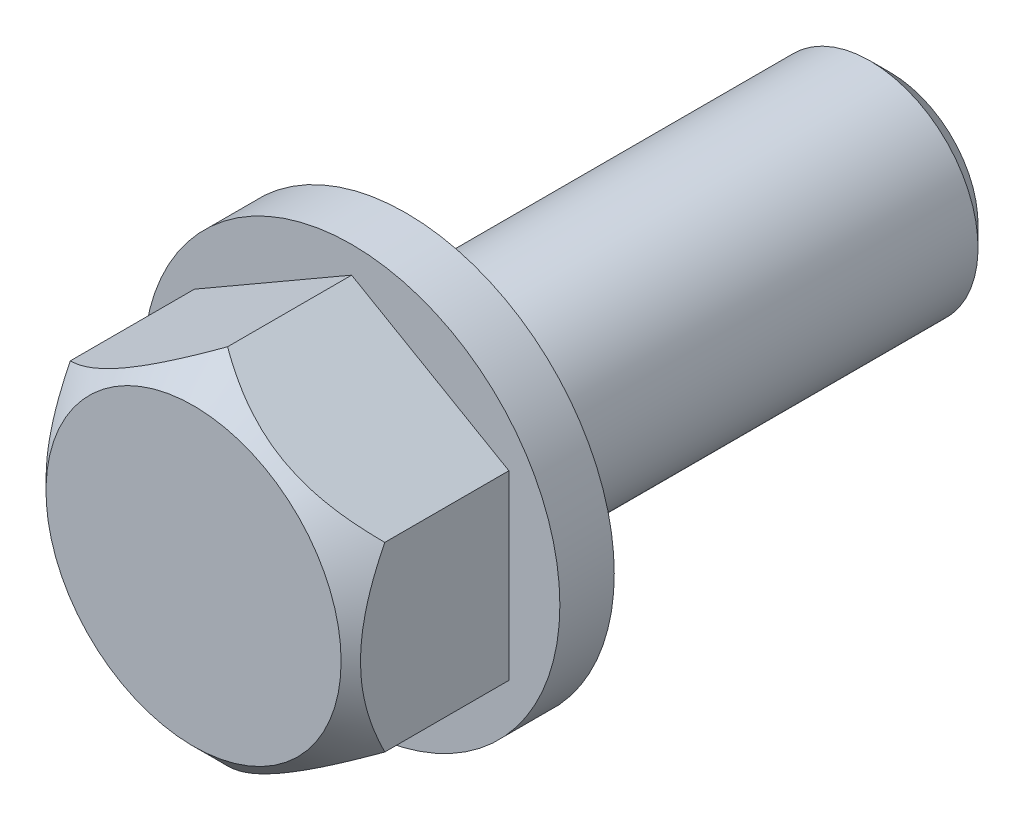
from build123d import *

# Parameters (mm, degrees)
BOSS_EXTRUDE1_DEPTH = 9.3
CHAMFER1_SIZE       = 1.2


with BuildPart() as part:
    # Sketch1 → Boss-Extrude1 (new body)
    with BuildSketch(Plane.XY):
        Polygon((9.25, -5.34048999), (9.25, 5.34048999), (0, 10.68097998), (-9.25, 5.34048999), (-9.25, -5.34048999), (0, -10.68097998), align=None)
    extrude(amount=-BOSS_EXTRUDE1_DEPTH)

    # Sketch2 → Revolve1 (revolve)
    with BuildSketch(Plane(origin=(0, 0, 0), x_dir=(0, 0, -1), z_dir=(1, 0, 0))):
        Polygon((9.3, 12.25), (12.5, 12.25), (12.5, 6.35), (41, 6.35), (41, 0), (9.3, 0), align=None)
    revolve(axis=Axis((0, 0, -41), (0, 0, 1)))

    # Sketch3 → Cut-Revolve1 (revolve, cut)
    with BuildSketch(Plane(origin=(0, 0, 0), x_dir=(0, 0, -1), z_dir=(1, 0, 0)), mode=Mode.PRIVATE) as cut_revolve1_sk:
        Polygon((0, 8.68097998), (2, 10.68097998), (0, 10.68097998), align=None)
    revolve(cut_revolve1_sk.sketch.rotate(Axis((0, 0, 0), (0, 0, -1)), 300.000000037), axis=Axis((0, 0, 0), (0, 0, -1)), mode=Mode.SUBTRACT)

    # Chamfer1
    chamfer1_edges = [part.edges().sort_by_distance(p)[0] for p in [
        (0, -6.35, -41),
    ]]
    chamfer(chamfer1_edges, length=CHAMFER1_SIZE)


solid = part.part
